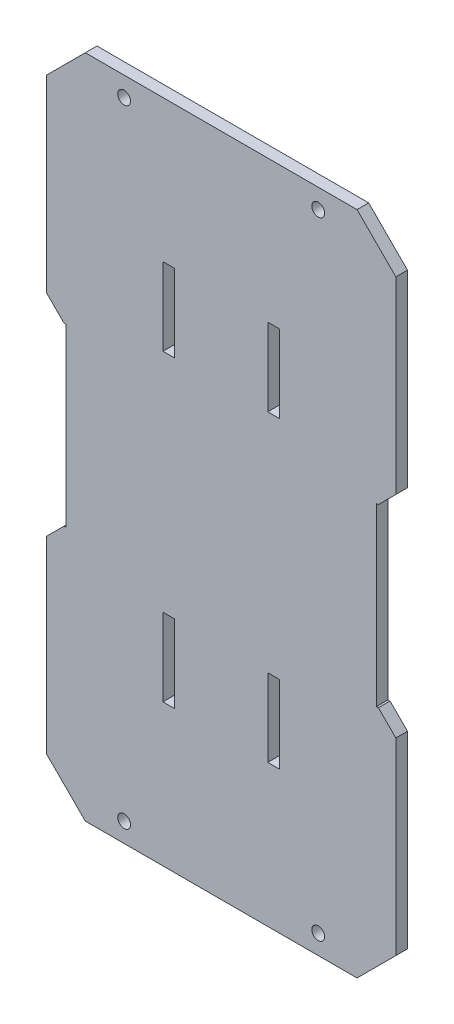
from build123d import *

# Parameters (mm, degrees)
SKETCH1_R           = 1.65
SKETCH1_W           = 3
SKETCH1_H           = 20
BOSS_EXTRUDE2_DEPTH = 3


with BuildPart() as part:
    # Sketch1 → Boss-Extrude2 (new body)
    with BuildSketch(Plane.XY):
        Polygon((-59.447183423, 47.780041818), (-49.447183423, 57.780041818), (20.552816577, 57.780041818), (30.552816577, 47.780041818), (30.552816577, -0.7691812), (26.052816577, -5.2691812), (25.552816577, -5.2691812), (25.552816577, -50.590735163), (26.052816577, -50.590735163), (30.552816577, -55.090735163), (30.552816577, -103.639958182), (20.552816577, -113.639958182), (-49.447183423, -113.639958182), (-59.447183423, -103.639958182), (-59.447183423, -55.090735163), (-54.947183423, -50.590735163), (-54.447183423, -50.590735163), (-54.447183423, -5.2691812), (-54.947183423, -5.2691812), (-59.447183423, -0.7691812), align=None)
        with Locations((-39.447183423, 52.780041818)):
            Circle(SKETCH1_R, mode=Mode.SUBTRACT)
        with Locations((10.552816577, 52.780041818)):
            Circle(SKETCH1_R, mode=Mode.SUBTRACT)
        with Locations(Location((10.552816577, -108.639958182, 0), (0, 0, 180))):
            Circle(SKETCH1_R, mode=Mode.SUBTRACT)
        with Locations(Location((-39.447183423, -108.639958182, 0), (0, 0, 180))):
            Circle(SKETCH1_R, mode=Mode.SUBTRACT)
        with Locations((-27.947183423, 11.175041818)):
            Rectangle(SKETCH1_W, SKETCH1_H, mode=Mode.SUBTRACT)
        with Locations((-0.947183423, 11.175041818)):
            Rectangle(SKETCH1_W, SKETCH1_H, mode=Mode.SUBTRACT)
        with Locations((-0.947183423, -67.034958182)):
            Rectangle(SKETCH1_W, SKETCH1_H, mode=Mode.SUBTRACT)
        with Locations((-27.947183423, -67.034958182)):
            Rectangle(SKETCH1_W, SKETCH1_H, mode=Mode.SUBTRACT)
    extrude(amount=BOSS_EXTRUDE2_DEPTH)


solid = part.part
